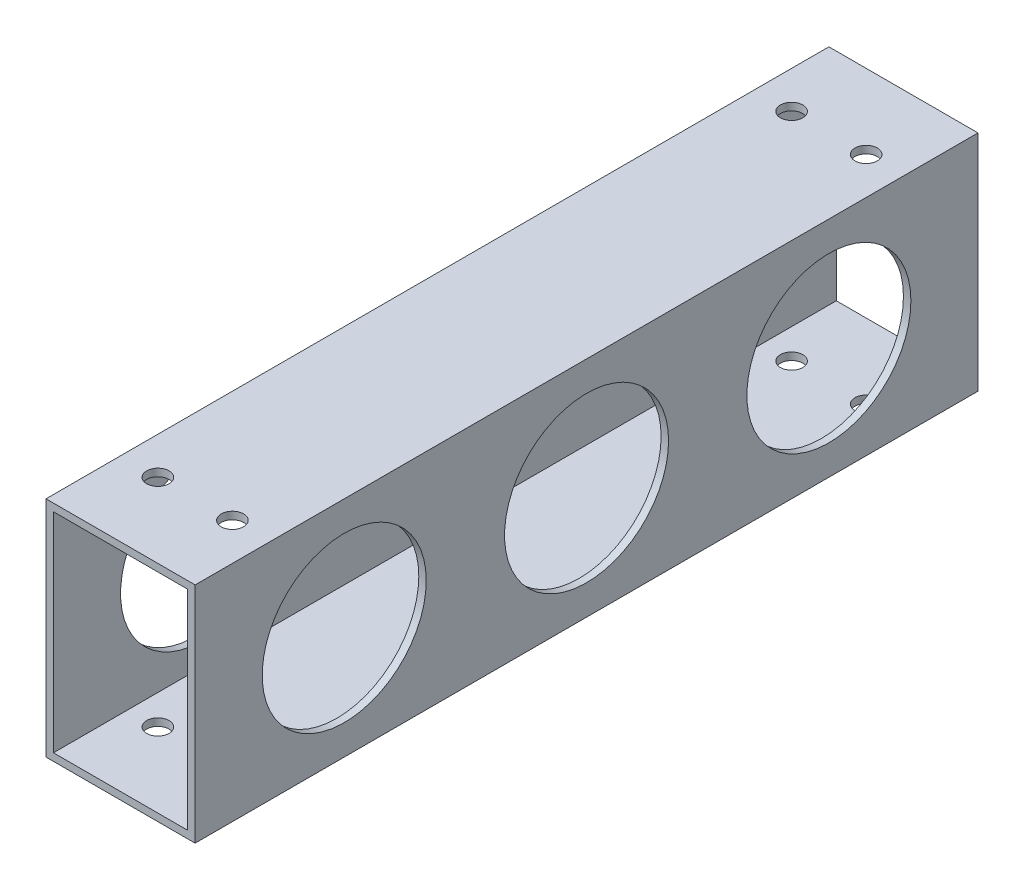
from build123d import *

# Parameters (mm, degrees)
SKETCH_1_W          = 20
SKETCH_1_H          = 30
SKETCH_1_W_2        = 18
SKETCH_1_H_2        = 28
EXTRUDE_1_DEPTH     = 105
CUT_EXTRUDE_1_REACH = 111.659
SKETCH_2_R          = 1.5
CUT_EXTRUDE_3_REACH = 109.935
SKETCH_5_R          = 11


with BuildPart() as part:
    # 草图1 → 拉伸-薄壁1 (new body)
    with BuildSketch(Plane.XY):
        Rectangle(SKETCH_1_W, SKETCH_1_H)
        Rectangle(SKETCH_1_W_2, SKETCH_1_H_2, mode=Mode.SUBTRACT)
    extrude(amount=EXTRUDE_1_DEPTH)

    # 切除-拉伸1: up to this face of the body (flat: up to its plane)
    cut_extrude_1_end = Plane(part.part.faces().sort_by_distance((0, -15, 52.5))[0])
    # 草图2 → 切除-拉伸1 (cut, up to the picked face)
    with BuildSketch(Plane(origin=(0, 15, 0), x_dir=(1, 0, 0), z_dir=(0, 1, 0)), mode=Mode.PRIVATE) as cut_extrude_1_sk1:
        with Locations(Location((5, -10, 0), (0, 0, 270))):
            Circle(SKETCH_2_R)
    cut_extrude_1_tool1 = split(extrude(cut_extrude_1_sk1.sketch, amount=-CUT_EXTRUDE_1_REACH, mode=Mode.PRIVATE), bisect_by=cut_extrude_1_end, keep=Keep.BOTH, mode=Mode.PRIVATE)
    # 草图2 → 切除-拉伸1 (cut, up to the picked face)
    with BuildSketch(Plane(origin=(0, 15, 0), x_dir=(1, 0, 0), z_dir=(0, 1, 0)), mode=Mode.PRIVATE) as cut_extrude_1_sk2:
        with Locations(Location((-5, -10, 0), (0, 0, 270))):
            Circle(SKETCH_2_R)
    cut_extrude_1_tool2 = split(extrude(cut_extrude_1_sk2.sketch, amount=-CUT_EXTRUDE_1_REACH, mode=Mode.PRIVATE), bisect_by=cut_extrude_1_end, keep=Keep.BOTH, mode=Mode.PRIVATE)
    # 草图2 → 切除-拉伸1 (cut, up to the picked face)
    with BuildSketch(Plane(origin=(0, 15, 0), x_dir=(1, 0, 0), z_dir=(0, 1, 0)), mode=Mode.PRIVATE) as cut_extrude_1_sk3:
        with Locations(Location((5, -95, 0), (0, 0, 270))):
            Circle(SKETCH_2_R)
    cut_extrude_1_tool3 = split(extrude(cut_extrude_1_sk3.sketch, amount=-CUT_EXTRUDE_1_REACH, mode=Mode.PRIVATE), bisect_by=cut_extrude_1_end, keep=Keep.BOTH, mode=Mode.PRIVATE)
    # 草图2 → 切除-拉伸1 (cut, up to the picked face)
    with BuildSketch(Plane(origin=(0, 15, 0), x_dir=(1, 0, 0), z_dir=(0, 1, 0)), mode=Mode.PRIVATE) as cut_extrude_1_sk4:
        with Locations(Location((-5, -95, 0), (0, 0, 270))):
            Circle(SKETCH_2_R)
    cut_extrude_1_tool4 = split(extrude(cut_extrude_1_sk4.sketch, amount=-CUT_EXTRUDE_1_REACH, mode=Mode.PRIVATE), bisect_by=cut_extrude_1_end, keep=Keep.BOTH, mode=Mode.PRIVATE)
    add(cut_extrude_1_tool1.solids().sort_by(Axis((5, 15, 10), (0, -1, 0)))[0], mode=Mode.SUBTRACT)
    add(cut_extrude_1_tool2.solids().sort_by(Axis((-5, 15, 10), (0, -1, 0)))[0], mode=Mode.SUBTRACT)
    add(cut_extrude_1_tool3.solids().sort_by(Axis((5, 15, 95), (0, -1, 0)))[0], mode=Mode.SUBTRACT)
    add(cut_extrude_1_tool4.solids().sort_by(Axis((-5, 15, 95), (0, -1, 0)))[0], mode=Mode.SUBTRACT)

    # 切除-拉伸3: up to this face of the body (flat: up to its plane)
    cut_extrude_3_end = Plane(part.part.faces().sort_by_distance((-10, 0, 52.5))[0])
    # 草图5 → 切除-拉伸3 (cut, up to the picked face)
    with BuildSketch(Plane(origin=(10, 0, 0), x_dir=(0, 0, -1), z_dir=(1, 0, 0)), mode=Mode.PRIVATE) as cut_extrude_3_sk1:
        with Locations((-20, 0)):
            Circle(SKETCH_5_R)
    cut_extrude_3_tool1 = split(extrude(cut_extrude_3_sk1.sketch, amount=-CUT_EXTRUDE_3_REACH, mode=Mode.PRIVATE), bisect_by=cut_extrude_3_end, keep=Keep.BOTH, mode=Mode.PRIVATE)
    # 草图5 → 切除-拉伸3 (cut, up to the picked face)
    with BuildSketch(Plane(origin=(10, 0, 0), x_dir=(0, 0, -1), z_dir=(1, 0, 0)), mode=Mode.PRIVATE) as cut_extrude_3_sk2:
        with Locations((-52.5, 0)):
            Circle(SKETCH_5_R)
    cut_extrude_3_tool2 = split(extrude(cut_extrude_3_sk2.sketch, amount=-CUT_EXTRUDE_3_REACH, mode=Mode.PRIVATE), bisect_by=cut_extrude_3_end, keep=Keep.BOTH, mode=Mode.PRIVATE)
    # 草图5 → 切除-拉伸3 (cut, up to the picked face)
    with BuildSketch(Plane(origin=(10, 0, 0), x_dir=(0, 0, -1), z_dir=(1, 0, 0)), mode=Mode.PRIVATE) as cut_extrude_3_sk3:
        with Locations((-85, 0)):
            Circle(SKETCH_5_R)
    cut_extrude_3_tool3 = split(extrude(cut_extrude_3_sk3.sketch, amount=-CUT_EXTRUDE_3_REACH, mode=Mode.PRIVATE), bisect_by=cut_extrude_3_end, keep=Keep.BOTH, mode=Mode.PRIVATE)
    add(cut_extrude_3_tool1.solids().sort_by(Axis((10, 0, 20), (-1, 0, 0)))[0], mode=Mode.SUBTRACT)
    add(cut_extrude_3_tool2.solids().sort_by(Axis((10, 0, 52.5), (-1, 0, 0)))[0], mode=Mode.SUBTRACT)
    add(cut_extrude_3_tool3.solids().sort_by(Axis((10, 0, 85), (-1, 0, 0)))[0], mode=Mode.SUBTRACT)


solid = part.part
